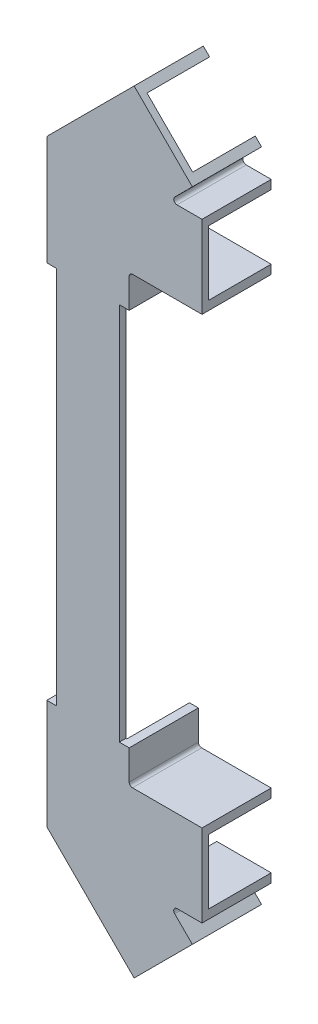
from build123d import *

# Parameters (mm, degrees)
BOSS_EXTRUDE1_DEPTH = 2
SKETCH2_W           = 24.813601178
SKETCH2_H           = 2.7
BOSS_EXTRUDE2_DEPTH = 19
SKETCH3_W           = 25
SKETCH3_H           = 10
BOSS_EXTRUDE3_DEPTH = 2
SKETCH4_W           = 2.7
SKETCH4_H           = 10
BOSS_EXTRUDE4_DEPTH = 19
FILLET1_R           = 1


with BuildPart() as part:
    # Sketch1 → Boss-Extrude1 (new body)
    with BuildSketch(Plane.XY):
        Polygon((-9.5, -67.5), (-12.5, -67.5), (-12.5, -90.741737881), (14.006999461, -117.248737342), (31.68466899, -99.571067812), (24.613601178, -92.5), (34.613601178, -92.5), (34.613601178, -67.5), (9.5, -67.5), (9.5, 67.5), (34.613601178, 67.5), (34.613601178, 92.5), (24.613601178, 92.5), (31.68466899, 99.571067812), (14.006999461, 117.248737342), (-12.5, 90.741737881), (-12.5, 67.5), (-9.5, 67.5), align=None)
    extrude(amount=BOSS_EXTRUDE1_DEPTH)

    # Sketch2 → Boss-Extrude2 (add)
    with BuildSketch(Plane(origin=(0, 0, 0), x_dir=(-1, 0, 0), z_dir=(0, 0, -1))):
        Polygon((-34.613601178, 89.8), (-34.613601178, 92.5), (-24.613601178, 92.5), (-31.68466899, 99.571067812), (-29.775480681, 101.480256121), (-18.09522456, 89.8), align=None)
        with Locations((-22.206800589, 68.85)):
            Rectangle(SKETCH2_W, SKETCH2_H)
        Polygon((9.8, 67.5), (12.5, 67.5), (12.5, 90.741737881), (-14.006999461, 117.248737342), (-15.91618777, 115.339549032), (9.8, 89.623361262), align=None)
        Polygon((-31.68466899, -99.571067812), (-29.775480681, -101.480256121), (-18.09522456, -89.8), (-34.613601178, -89.8), (-34.613601178, -92.5), (-24.613601178, -92.5), align=None)
        with Locations((-22.206800589, -68.85)):
            Rectangle(SKETCH2_W, SKETCH2_H)
        Polygon((-14.006999461, -117.248737342), (-15.91618777, -115.339549032), (9.8, -89.623361262), (9.8, -67.5), (12.5, -67.5), (12.5, -90.741737881), align=None)
    extrude(amount=BOSS_EXTRUDE2_DEPTH)

    # Sketch3 → Boss-Extrude3 (add)
    with BuildSketch(Plane.XY.offset(2)):
        with Locations((0, -62.5)):
            Rectangle(SKETCH3_W, SKETCH3_H)
        with Locations((0, 62.5)):
            Rectangle(SKETCH3_W, SKETCH3_H)
    extrude(amount=-BOSS_EXTRUDE3_DEPTH)

    # Sketch4 → Boss-Extrude4 (add)
    with BuildSketch(Plane(origin=(0, 0, 0), x_dir=(-1, 0, 0), z_dir=(0, 0, -1))):
        with Locations((11.15, 62.5)):
            Rectangle(SKETCH4_W, SKETCH4_H)
        with Locations((-11.15, 62.5)):
            Rectangle(SKETCH4_W, SKETCH4_H)
        with Locations((11.15, -62.5)):
            Rectangle(SKETCH4_W, SKETCH4_H)
        with Locations((-11.15, -62.5)):
            Rectangle(SKETCH4_W, SKETCH4_H)
    extrude(amount=BOSS_EXTRUDE4_DEPTH)

    # Fillet1
    fillet1_edges = [part.edges().sort_by_distance(p)[0] for p in [
        (12.5, -67.5, -8.5),
        (12.5, 67.5, -8.5),
        (-12.5, 90.741737881, -8.5),
        (24.613601178, 92.5, -8.5),
        (24.613601178, -92.5, -8.5),
        (-12.5, -90.741737881, -8.5),
    ]]
    fillet(fillet1_edges, radius=FILLET1_R)


solid = part.part
